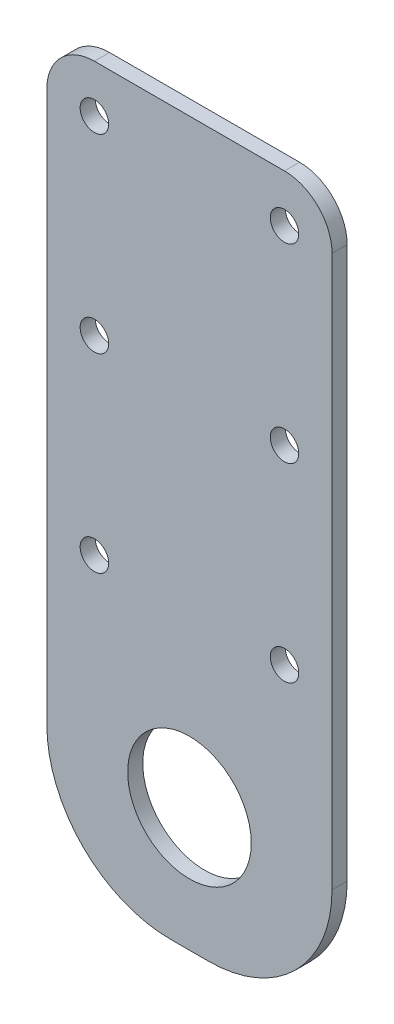
from build123d import *

# Parameters (mm, degrees)
SKETCH1_R           = 6.5
SKETCH1_R_2         = 1.5
BOSS_EXTRUDE1_DEPTH = 1.5875
FILLET1_R           = 5
FILLET2_R           = 13


with BuildPart() as part:
    # Sketch1 → Boss-Extrude1 (new body)
    with BuildSketch(Plane.XY):
        Polygon((0, 0), (0, 50), (30, 50), (30, 0), (30, -26), (0, -26), align=None)
        with Locations((15, -13)):
            Circle(SKETCH1_R, mode=Mode.SUBTRACT)
        with Locations((5, 45)):
            Circle(SKETCH1_R_2, mode=Mode.SUBTRACT)
        with Locations((5, 25)):
            Circle(SKETCH1_R_2, mode=Mode.SUBTRACT)
        with Locations((5, 5)):
            Circle(SKETCH1_R_2, mode=Mode.SUBTRACT)
        with Locations(Location((25, 5, 0), (0, 0, 180))):
            Circle(SKETCH1_R_2, mode=Mode.SUBTRACT)
        with Locations(Location((25, 25, 0), (0, 0, 180))):
            Circle(SKETCH1_R_2, mode=Mode.SUBTRACT)
        with Locations(Location((25, 45, 0), (0, 0, 180))):
            Circle(SKETCH1_R_2, mode=Mode.SUBTRACT)
    extrude(amount=BOSS_EXTRUDE1_DEPTH)

    # Fillet1
    fillet1_edges = [part.edges().sort_by_distance(p)[0] for p in [
        (0, 50, 0.79375),
        (30, 50, 0.79375),
    ]]
    fillet(fillet1_edges, radius=FILLET1_R)

    # Fillet2
    fillet2_edges = [part.edges().sort_by_distance(p)[0] for p in [
        (30, -26, 0.79375),
        (0, -26, 0.79375),
    ]]
    fillet(fillet2_edges, radius=FILLET2_R)


solid = part.part
